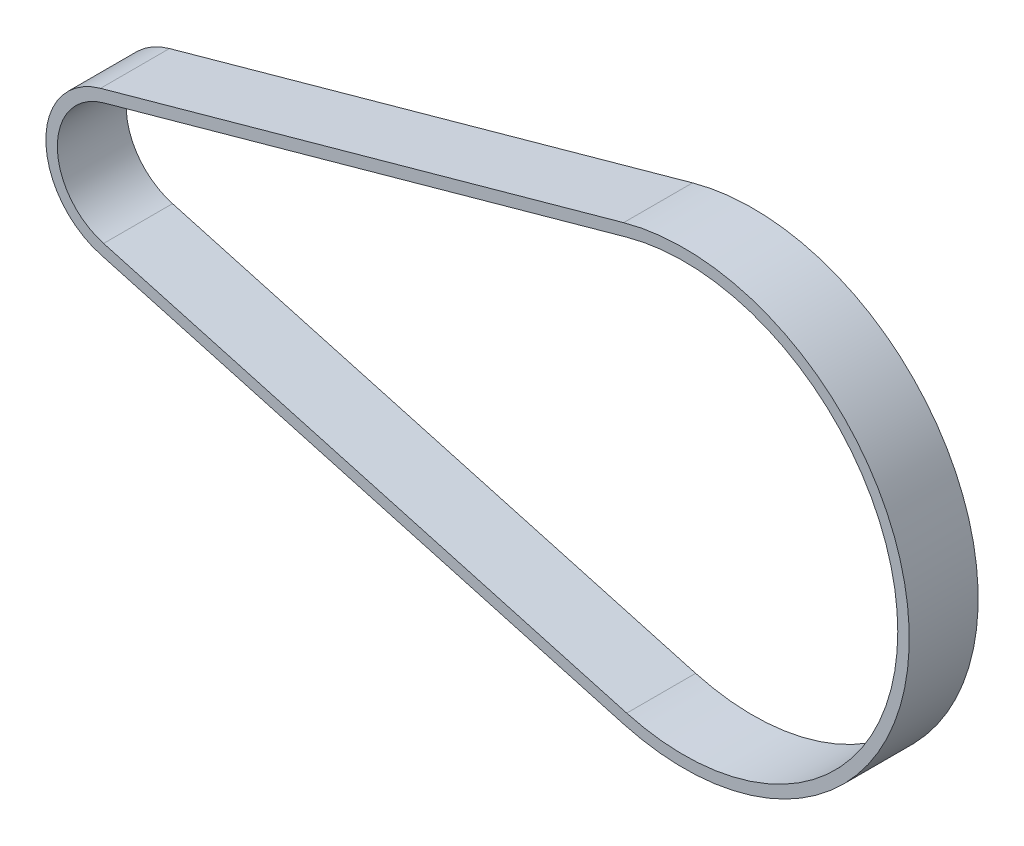
from build123d import *

# Parameters (mm, degrees)
SALIENTE_EXTRUIR1_DEPTH = 6


with BuildPart() as part:
    # Croquis1 → Saliente-Extruir1 (new body)
    with BuildSketch(Plane.XY):
        with BuildLine():
            Line((-1.738634047, 6.263158281), (43.802, 18.90510238))
            ThreePointArc((43.802, 18.90510238), (68.67, 0), (43.802, -18.90510238))
            Line((43.802, -18.90510238), (-1.738634047, -6.263158281))
            ThreePointArc((-1.738634047, -6.263158281), (-6.5, 0), (-1.738634047, 6.263158281))
        make_face()
        with BuildLine():
            Line((-1.471151886, 5.299595468), (44.069482161, 17.941539568))
            ThreePointArc((44.069482161, 17.941539568), (67.67, 0), (44.069482161, -17.941539568))
            Line((44.069482161, -17.941539568), (-1.471151886, -5.299595468))
            ThreePointArc((-1.471151886, -5.299595468), (-5.5, 0), (-1.471151886, 5.299595468))
        make_face(mode=Mode.SUBTRACT)
    extrude(amount=SALIENTE_EXTRUIR1_DEPTH)


solid = part.part
